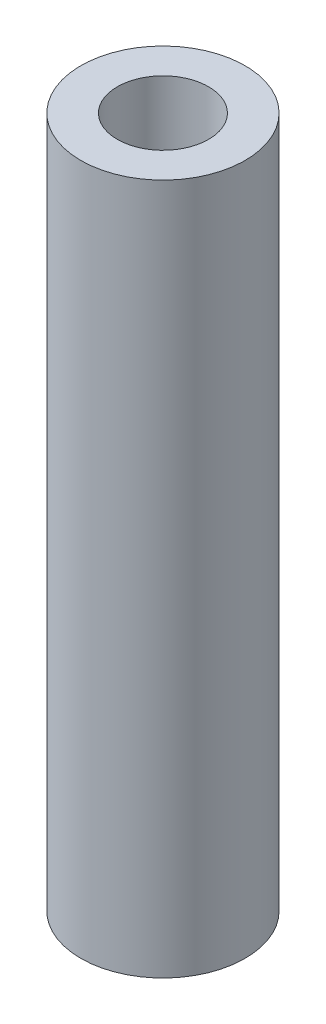
from build123d import *

# Parameters (mm, degrees)
SZKIC1_W = 28
SZKIC1_H = 530


with BuildPart() as part:
    # Szkic1 → Obrót1 (revolve)
    with BuildSketch(Plane.XY, mode=Mode.PRIVATE) as obr_t1_sk:
        with Locations((49, 0)):
            Rectangle(SZKIC1_W, SZKIC1_H)
    revolve(obr_t1_sk.sketch.rotate(Axis((0, 344.744344029, 0), (0, -1, 0)), 90), axis=Axis((0, 344.744344029, 0), (0, -1, 0)))


solid = part.part
